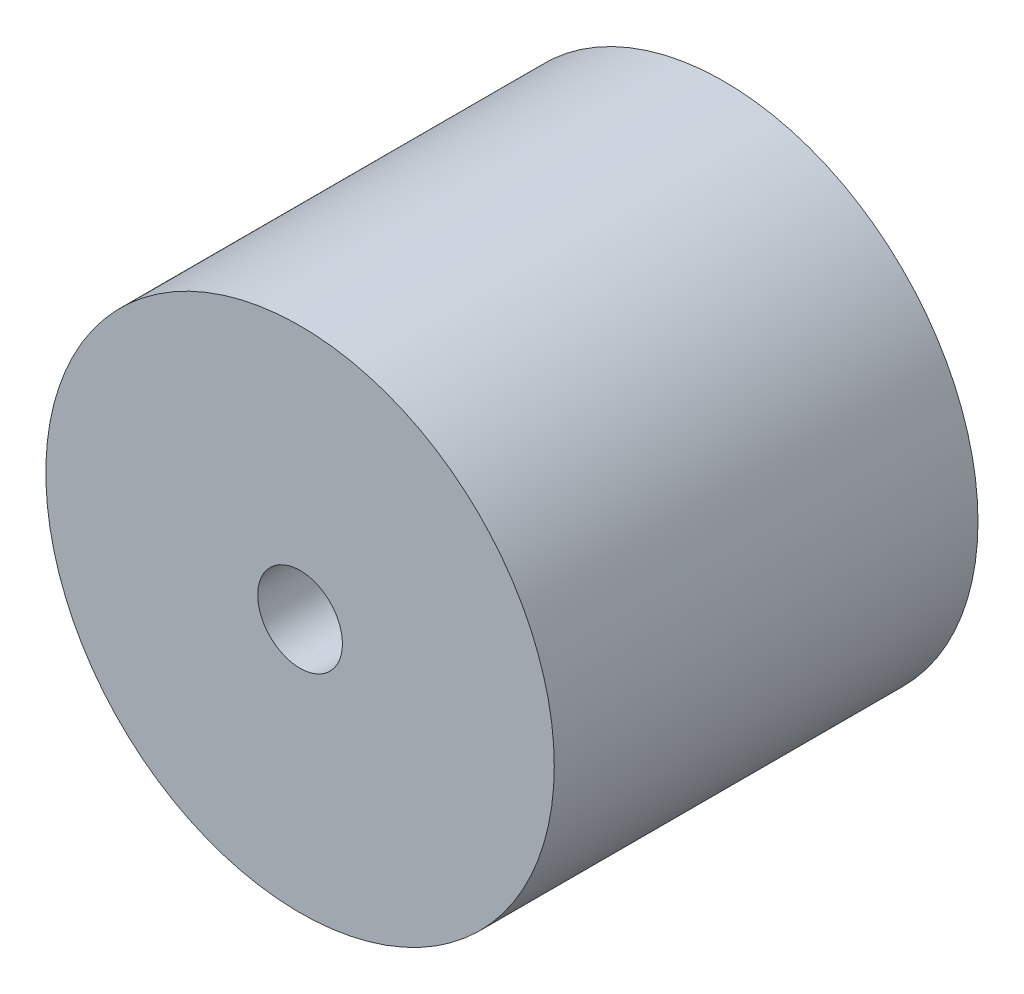
from build123d import *

# Parameters (mm, degrees)
SKETCH1_R           = 18
BOSS_EXTRUDE1_DEPTH = 30
SKETCH2_R           = 3
CUT_EXTRUDE1_DEPTH  = 40.344631146


with BuildPart() as part:
    # Sketch1 → Boss-Extrude1 (new body)
    with BuildSketch(Plane.XY):
        Circle(SKETCH1_R)
    extrude(amount=BOSS_EXTRUDE1_DEPTH)

    # Sketch2 → Cut-Extrude1 (cut, through all)
    with BuildSketch(Plane.XY.offset(30)):
        Circle(SKETCH2_R)
    extrude(amount=-CUT_EXTRUDE1_DEPTH, mode=Mode.SUBTRACT)


solid = part.part
